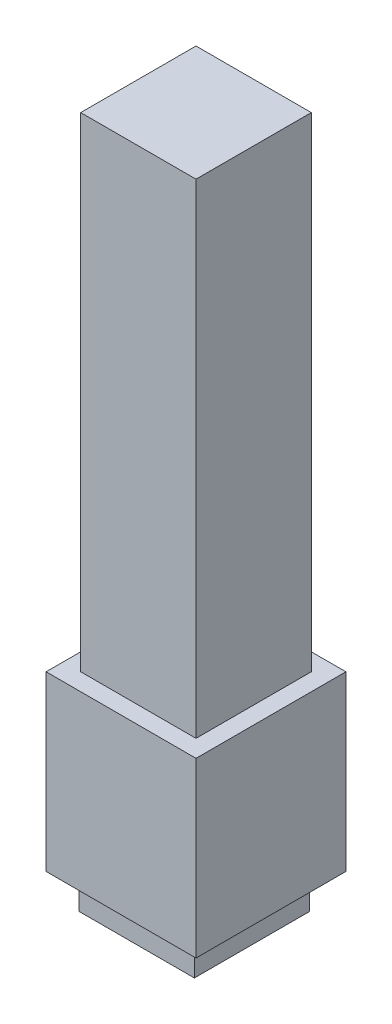
from build123d import *

# Parameters (mm, degrees)
SKETCH1_W           = 508
SKETCH1_H           = 508
BOSS_EXTRUDE1_DEPTH = 152.4
SKETCH2_W           = 660.4
SKETCH2_H           = 660.4
BOSS_EXTRUDE2_DEPTH = 762
SKETCH3_W           = 508
SKETCH3_H           = 508
BOSS_EXTRUDE3_DEPTH = 2133.6


with BuildPart() as part:
    # Sketch1 → Boss-Extrude1 (new body)
    with BuildSketch(Plane(origin=(0, 0, 0), x_dir=(1, 0, 0), z_dir=(0, 1, 0))):
        with Locations((254, 254)):
            Rectangle(SKETCH1_W, SKETCH1_H)
    extrude(amount=BOSS_EXTRUDE1_DEPTH)

    # Sketch2 → Boss-Extrude2 (add)
    with BuildSketch(Plane(origin=(0, 152.4, 0), x_dir=(1, 0, 0), z_dir=(0, 1, 0))):
        with Locations((257.591048246, 257.591048246)):
            Rectangle(SKETCH2_W, SKETCH2_H)
    extrude(amount=BOSS_EXTRUDE2_DEPTH)

    # Sketch3 → Boss-Extrude3 (add)
    with BuildSketch(Plane(origin=(0, 914.4, 0), x_dir=(1, 0, 0), z_dir=(0, 1, 0))):
        with Locations((257.591048246, 257.591048246)):
            Rectangle(SKETCH3_W, SKETCH3_H)
    extrude(amount=BOSS_EXTRUDE3_DEPTH)


solid = part.part
